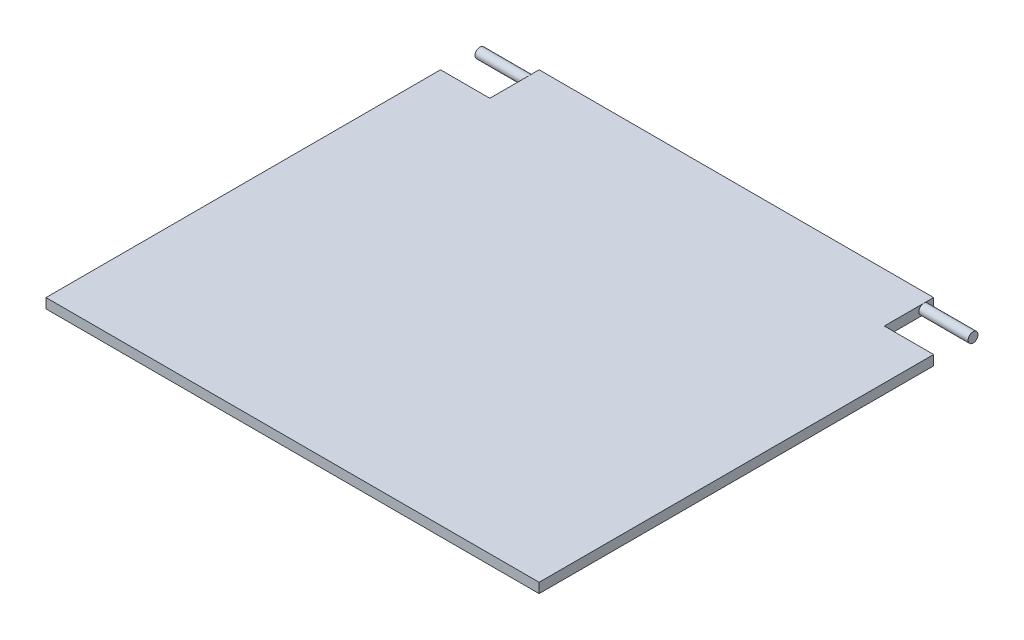
from build123d import *

# Parameters (mm, degrees)
SKETCH1_W           = 500
SKETCH1_H           = 400
BOSS_EXTRUDE1_DEPTH = 10
SKETCH2_W           = 400
SKETCH2_H           = 50
BOSS_EXTRUDE2_DEPTH = 10
SKETCH3_R           = 5
BOSS_EXTRUDE5_DEPTH = 50


with BuildPart() as part:
    # Sketch1 → Boss-Extrude1 (new body)
    with BuildSketch(Plane(origin=(0, 0, 0), x_dir=(1, 0, 0), z_dir=(0, 1, 0))):
        Rectangle(SKETCH1_W, SKETCH1_H)
    extrude(amount=BOSS_EXTRUDE1_DEPTH)

    # Sketch2 → Boss-Extrude2 (add)
    with BuildSketch(Plane(origin=(0, 10, 0), x_dir=(1, 0, 0), z_dir=(0, 1, 0))):
        with Locations((0, 225)):
            Rectangle(SKETCH2_W, SKETCH2_H)
    extrude(amount=-BOSS_EXTRUDE2_DEPTH)

    # Sketch3 → Boss-Extrude5 (add)
    with BuildSketch(Plane.ZY.offset(200)):
        with Locations(Location((-240, 5, 0), (0, 0, 270))):
            Circle(SKETCH3_R)
    boss_extrude5 = extrude(amount=BOSS_EXTRUDE5_DEPTH)

    # Mirror1: Boss-Extrude5 across plane
    add(boss_extrude5.mirror(Plane(origin=(0, 0, 0), x_dir=(0, 0, 1), z_dir=(1, 0, 0))))


solid = part.part
